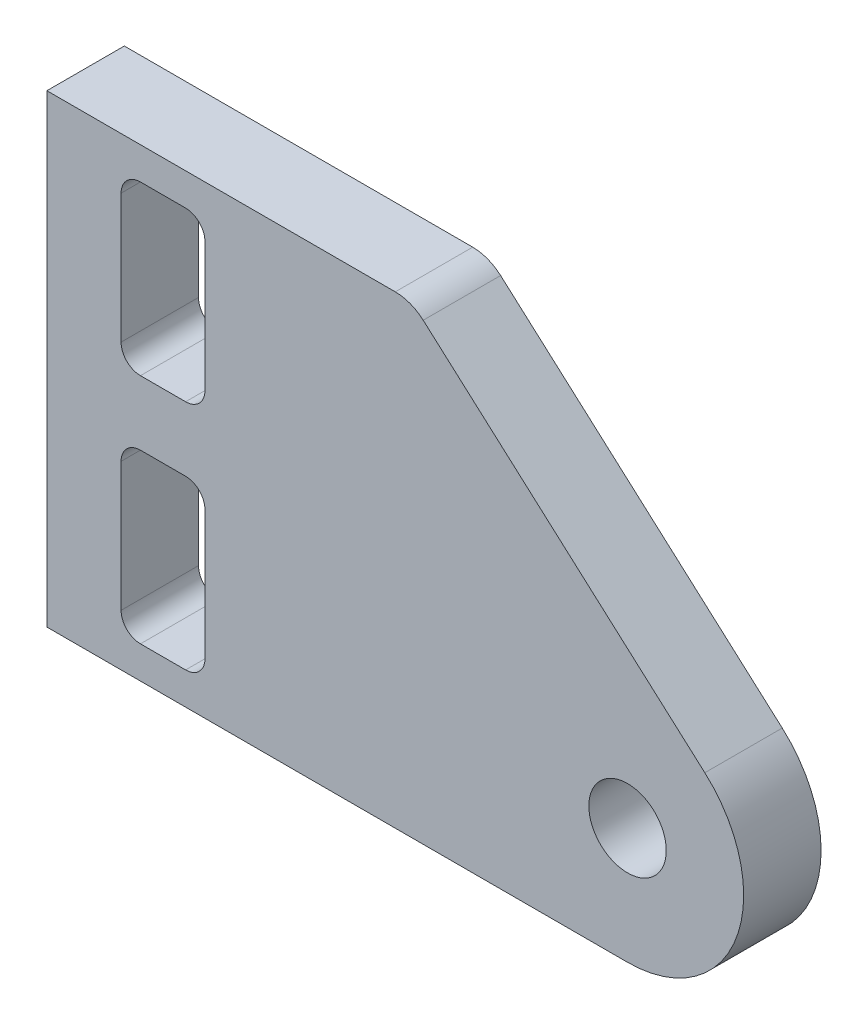
from build123d import *

# Parameters (mm, degrees)
MODEL_R                 = 1.5
SALIENTE_EXTRUIR1_DEPTH = 3


with BuildPart() as part:
    # Model → Saliente-Extruir1 (new body)
    with BuildSketch(Plane.XY):
        with BuildLine():
            Line((201.097853309, 264.646547335), (178.597853309, 264.646547335))
            Line((178.597853309, 264.646547335), (178.597853309, 282.646547335))
            Line((178.597853309, 282.646547335), (192.097853309, 282.646547335))
            ThreePointArc((192.097853309, 282.646547335), (192.676448554, 282.540050724), (193.179205728, 282.234519695))
            Line((193.179205728, 282.234519695), (204.092367701, 272.505547716))
            ThreePointArc((204.092367701, 272.505547716), (205.302939617, 267.544283579), (201.097853309, 264.646547335))
        make_face()
        with Locations((201.097853309, 269.146547335)):
            Circle(MODEL_R, mode=Mode.SUBTRACT)
        with BuildLine():
            Line((182.222853309, 265.896547335), (183.972853309, 265.896547335))
            ThreePointArc((183.972853309, 265.896547335), (184.503183395, 266.116217249), (184.722853309, 266.646547335))
            Line((184.722853309, 266.646547335), (184.722853309, 271.646547335))
            ThreePointArc((184.722853309, 271.646547335), (184.503183395, 272.176877421), (183.972853309, 272.396547335))
            Line((183.972853309, 272.396547335), (182.222853309, 272.396547335))
            ThreePointArc((182.222853309, 272.396547335), (181.692523223, 272.176877421), (181.472853309, 271.646547335))
            Line((181.472853309, 271.646547335), (181.472853309, 266.646547335))
            ThreePointArc((181.472853309, 266.646547335), (181.692523223, 266.116217249), (182.222853309, 265.896547335))
        make_face(mode=Mode.SUBTRACT)
        with BuildLine():
            Line((182.222853309, 274.895968764), (183.972853309, 274.895968764))
            ThreePointArc((183.972853309, 274.895968764), (184.503183395, 275.115638678), (184.722853309, 275.645968764))
            Line((184.722853309, 275.645968764), (184.722853309, 280.645968764))
            ThreePointArc((184.722853309, 280.645968764), (184.503183395, 281.17629885), (183.972853309, 281.395968764))
            Line((183.972853309, 281.395968764), (182.222853309, 281.395968764))
            ThreePointArc((182.222853309, 281.395968764), (181.692523223, 281.17629885), (181.472853309, 280.645968764))
            Line((181.472853309, 280.645968764), (181.472853309, 275.645968764))
            ThreePointArc((181.472853309, 275.645968764), (181.692523223, 275.115638678), (182.222853309, 274.895968764))
        make_face(mode=Mode.SUBTRACT)
    extrude(amount=SALIENTE_EXTRUIR1_DEPTH)


solid = part.part
